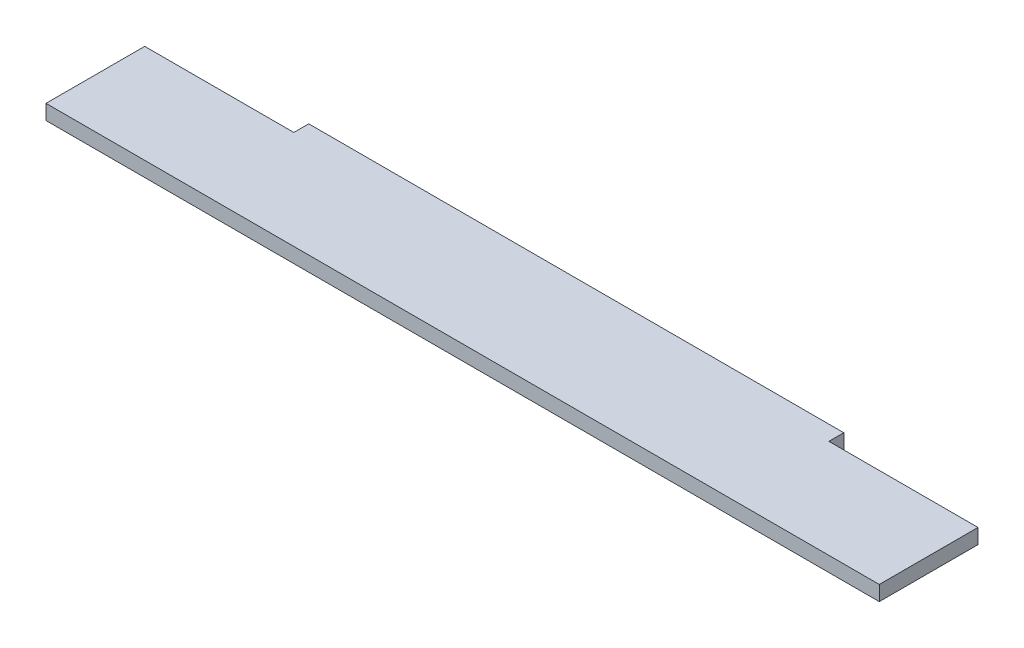
from build123d import *

# Parameters (mm, degrees)
BOSS_EXTRUDE1_DEPTH = 5


with BuildPart() as part:
    # Sketch1 → Boss-Extrude1 (new body)
    with BuildSketch(Plane(origin=(0, 0, 0), x_dir=(1, 0, 0), z_dir=(0, 1, 0))):
        Polygon((-139.7, -33.1), (-139.7, 0), (-89.7, 0), (-89.7, 5), (89.7, 5), (89.7, 0), (139.7, 0), (139.7, -33.1), align=None)
    extrude(amount=BOSS_EXTRUDE1_DEPTH)


solid = part.part
